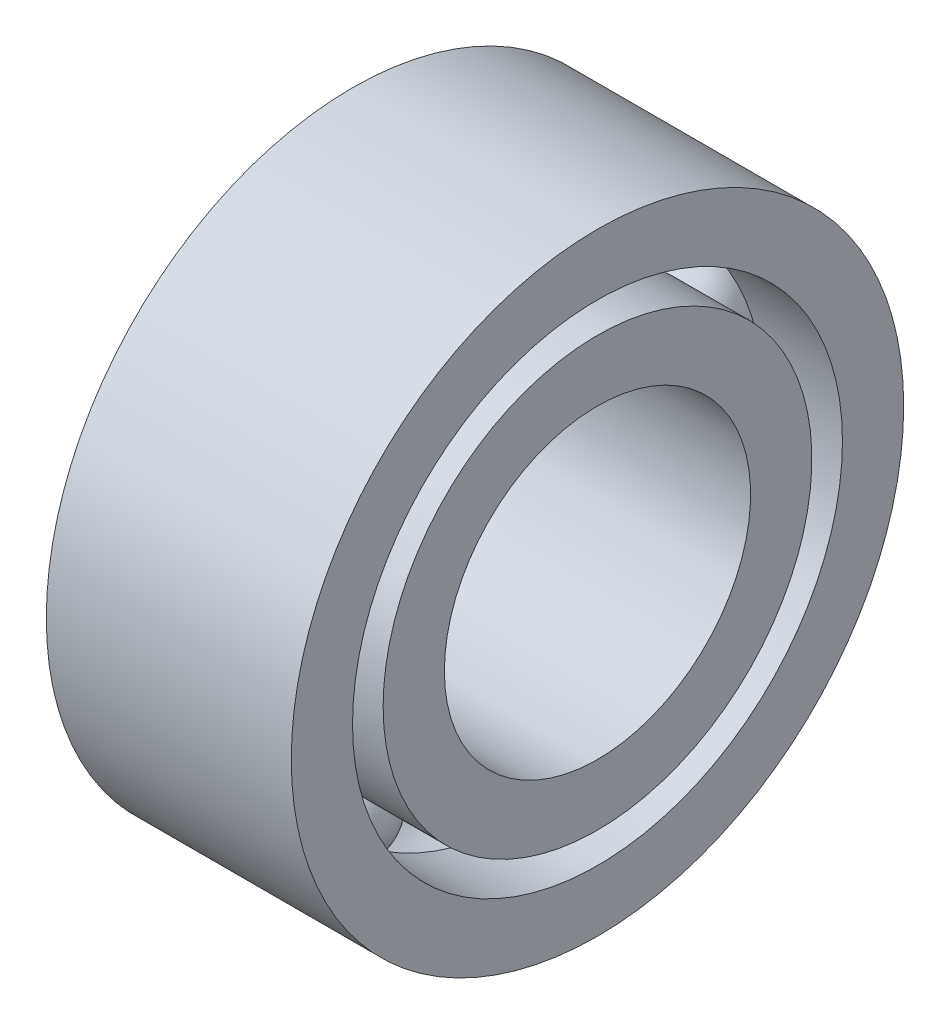
from build123d import *

# Parameters (mm, degrees)
CIRPATTERN1_COUNT = 10


with BuildPart() as part:
    # Sketch1 → Revolve1 (revolve)
    with BuildSketch(Plane.XY, mode=Mode.PRIVATE) as revolve1_sk:
        with BuildLine():
            Line((0, 5), (2, 5))
            Line((2, 5), (2, 4))
            Line((2, 4), (0.707106781, 4))
            ThreePointArc((0.707106781, 4), (0, 4.5), (-0.707106781, 4))
            Line((-0.707106781, 4), (-2, 4))
            Line((-2, 4), (-2, 5))
            Line((-2, 5), (0, 5))
        make_face()
        with BuildLine():
            Line((0.707106781, 3.5), (2, 3.5))
            Line((2, 3.5), (2, 2.5))
            Line((2, 2.5), (-2, 2.5))
            Line((-2, 2.5), (-2, 3.5))
            Line((-2, 3.5), (-0.707106781, 3.5))
            ThreePointArc((-0.707106781, 3.5), (0, 3), (0.707106781, 3.5))
        make_face()
    revolve(revolve1_sk.sketch.rotate(Axis((-3.653206843, 0, 0), (1, 0, 0)), 90), axis=Axis((-3.653206843, 0, 0), (1, 0, 0)))


with BuildPart() as body_2:
    # Sketch2 → Revolve2 (revolve)
    with BuildSketch(Plane.XY):
        with BuildLine():
            Line((-0.75, 3.75), (0.75, 3.75))
            ThreePointArc((0.75, 3.75), (0, 4.5), (-0.75, 3.75))
        make_face()
    revolve(axis=Axis((-0.75, 3.75, 0), (1, 0, 0)))


with BuildPart() as cirpattern1_1:
    # CirPattern1: pattern copy
    add(body_2.part.rotate(Axis((0, 0, 0), (1, 0, 0)), 1 * 360 / CIRPATTERN1_COUNT))


with BuildPart() as cirpattern1_2:
    # CirPattern1: pattern copy
    add(body_2.part.rotate(Axis((0, 0, 0), (1, 0, 0)), 2 * 360 / CIRPATTERN1_COUNT))


with BuildPart() as cirpattern1_3:
    # CirPattern1: pattern copy
    add(body_2.part.rotate(Axis((0, 0, 0), (1, 0, 0)), 3 * 360 / CIRPATTERN1_COUNT))


with BuildPart() as cirpattern1_4:
    # CirPattern1: pattern copy
    add(body_2.part.rotate(Axis((0, 0, 0), (1, 0, 0)), 4 * 360 / CIRPATTERN1_COUNT))


with BuildPart() as cirpattern1_5:
    # CirPattern1: pattern copy
    add(body_2.part.rotate(Axis((0, 0, 0), (1, 0, 0)), 5 * 360 / CIRPATTERN1_COUNT))


with BuildPart() as cirpattern1_6:
    # CirPattern1: pattern copy
    add(body_2.part.rotate(Axis((0, 0, 0), (1, 0, 0)), 6 * 360 / CIRPATTERN1_COUNT))


with BuildPart() as cirpattern1_7:
    # CirPattern1: pattern copy
    add(body_2.part.rotate(Axis((0, 0, 0), (1, 0, 0)), 7 * 360 / CIRPATTERN1_COUNT))


with BuildPart() as cirpattern1_8:
    # CirPattern1: pattern copy
    add(body_2.part.rotate(Axis((0, 0, 0), (1, 0, 0)), 8 * 360 / CIRPATTERN1_COUNT))


with BuildPart() as cirpattern1_9:
    # CirPattern1: pattern copy
    add(body_2.part.rotate(Axis((0, 0, 0), (1, 0, 0)), 9 * 360 / CIRPATTERN1_COUNT))


solid = Compound([part.part, body_2.part, cirpattern1_1.part, cirpattern1_2.part, cirpattern1_3.part, cirpattern1_4.part, cirpattern1_5.part, cirpattern1_6.part, cirpattern1_7.part, cirpattern1_8.part, cirpattern1_9.part])
